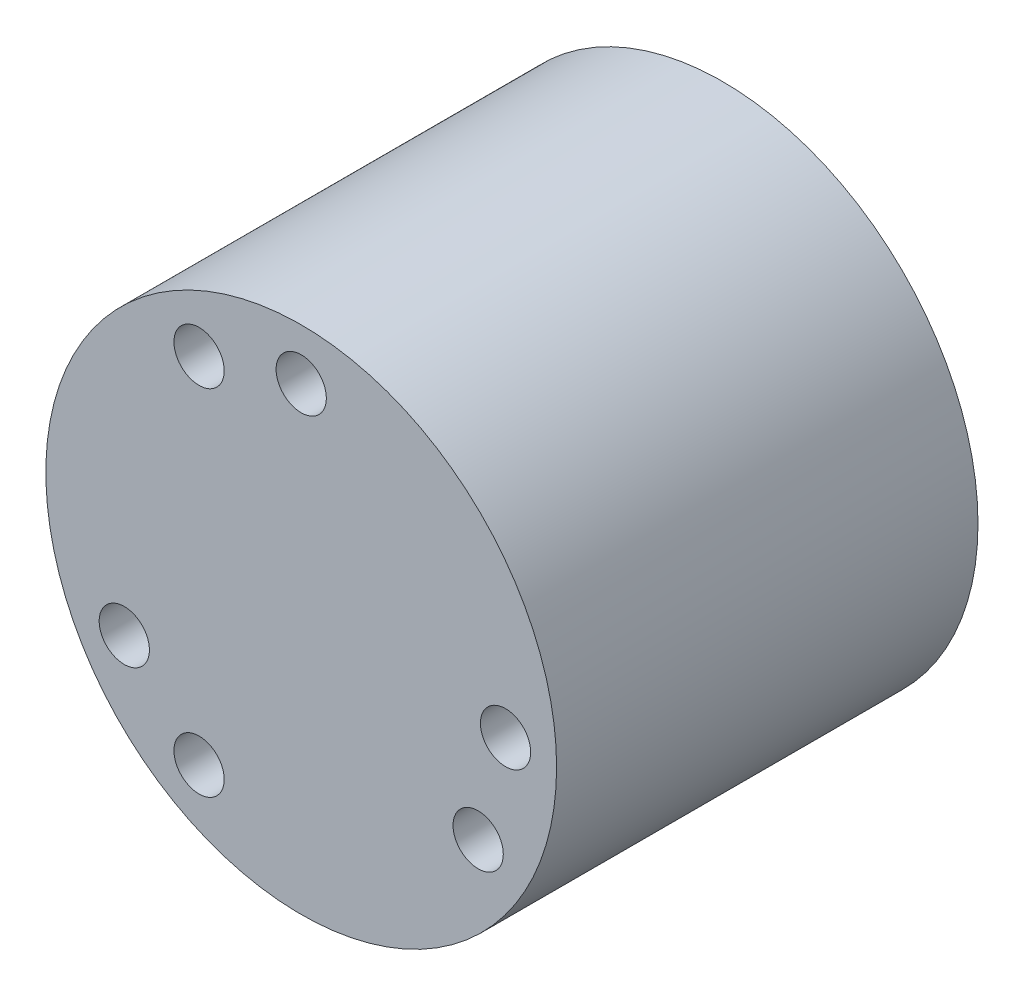
from build123d import *

# Parameters (mm, degrees)
SKETCH1_R                   = 12.7
BOSS_EXTRUDE1_DEPTH         = 20.955
SKETCH2_R                   = 1.24968
CUT_EXTRUDE1_DEPTH          = 25.4
CIRPATTERN1_COUNT           = 3
CIRPATTERN2_COUNT           = 2
CIRPATTERN2_ANGLE           = 30
CIRPATTERN2_COPY_1_SKETCH_R = 1.24968
CIRPATTERN2_COPY_1_DEPTH    = 25.4
CIRPATTERN2_COPY_2_SKETCH_R = 1.24968
CIRPATTERN2_COPY_2_DEPTH    = 25.4


with BuildPart() as part:
    # Sketch1 → Boss-Extrude1 (new body)
    with BuildSketch(Plane.XY):
        Circle(SKETCH1_R)
    extrude(amount=BOSS_EXTRUDE1_DEPTH)

    # Sketch2 → Cut-Extrude1 (cut)
    with BuildSketch(Plane(origin=(0, 0, 0), x_dir=(-1, 0, 0), z_dir=(0, 0, -1))):
        with Locations((0, 10.16)):
            Circle(SKETCH2_R)
    cut_extrude1 = extrude(amount=-CUT_EXTRUDE1_DEPTH, mode=Mode.SUBTRACT)

    # CirPattern1: Cut-Extrude1 ×3 about axis
    cirpattern1_axis = Axis((0, 0, 0), (0, 0, 1))
    for i in range(1, CIRPATTERN1_COUNT):
        add(cut_extrude1.rotate(cirpattern1_axis, i * 360 / CIRPATTERN1_COUNT), mode=Mode.SUBTRACT)

    # CirPattern2: Cut-Extrude1 ×2 about axis
    cirpattern2_axis = Axis((0, 0, 0), (0, 0, 1))
    for i in range(1, CIRPATTERN2_COUNT):
        add(cut_extrude1.rotate(cirpattern2_axis, i * CIRPATTERN2_ANGLE / (CIRPATTERN2_COUNT - 1)), mode=Mode.SUBTRACT)

    # CirPattern2 copy 1 sketch → CirPattern2 copy 1 (cut)
    with BuildSketch(Plane(origin=(0, 0, 0), x_dir=(0.8660254037844392, -0.4999999999999991, 0), z_dir=(0, 0, -1))):
        with Locations((0, 10.16)):
            Circle(CIRPATTERN2_COPY_1_SKETCH_R)
    extrude(amount=-CIRPATTERN2_COPY_1_DEPTH, mode=Mode.SUBTRACT)

    # CirPattern2 copy 2 sketch → CirPattern2 copy 2 (cut)
    with BuildSketch(Plane.YX):
        with Locations((0, 10.16)):
            Circle(CIRPATTERN2_COPY_2_SKETCH_R)
    extrude(amount=-CIRPATTERN2_COPY_2_DEPTH, mode=Mode.SUBTRACT)


solid = part.part
